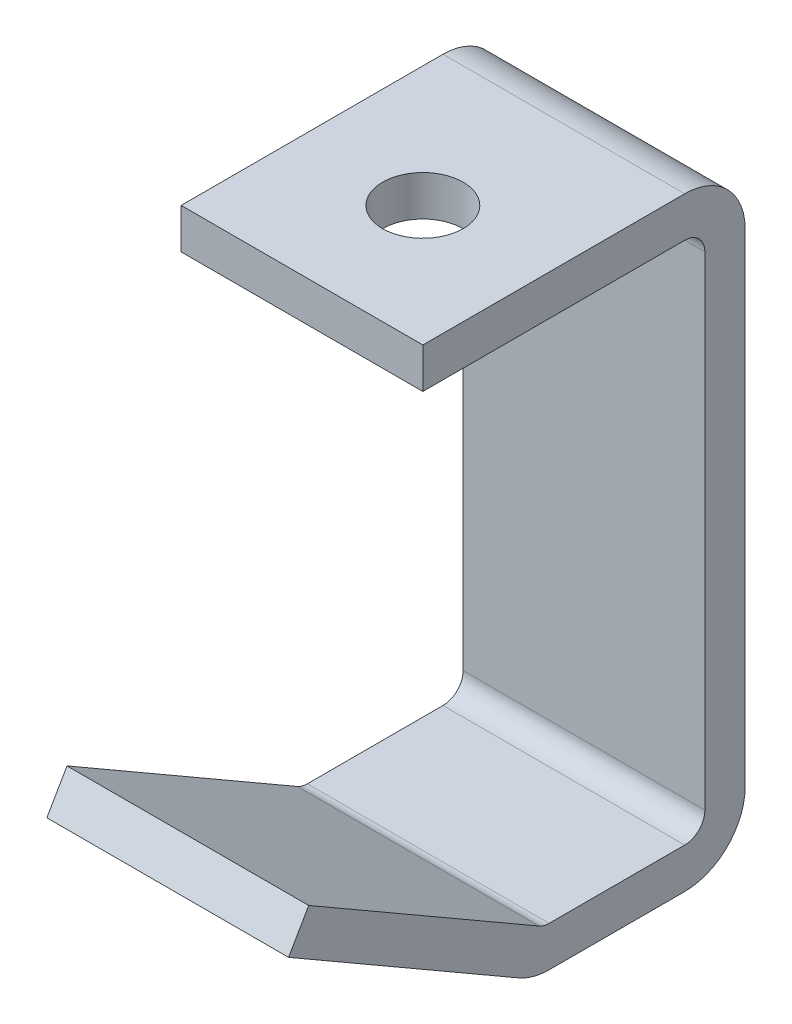
from build123d import *

# Parameters (mm, degrees)
EXTRUDE_1_DEPTH     = 38.1
SKETCH_2_W          = 38.1
SKETCH_2_H          = 6.35
EXTRUDE_2_DEPTH     = 88.9
SKETCH_3_W          = 38.1
SKETCH_3_H          = 6.35
EXTRUDE_3_DEPTH     = 44.45
HOLE_WIZARD_1_D     = 12.7
HOLE_WIZARD_1_DEPTH = 6.35
FILLET_1_R          = 3.175
FILLET_2_R          = 9.525


with BuildPart() as part:
    # 스케치1 → 보스-돌출1 (new body)
    with BuildSketch(Plane(origin=(38.1, 0, 0), x_dir=(0, 0, -1), z_dir=(1, 0, 0))):
        Polygon((0, 0), (0, 6.35), (-31.75, 6.35), (-68.793024211, 27.7368), (-71.968024211, 22.237538686), (-33.451477372, 0), align=None)
    extrude(amount=-EXTRUDE_1_DEPTH)

    # 스케치2 → 보스-돌출2 (add)
    with BuildSketch(Plane(origin=(0, 6.35, 0), x_dir=(-1, 0, 0), z_dir=(0, 1, 0))):
        with Locations((-19.05, 3.175)):
            Rectangle(SKETCH_2_W, SKETCH_2_H)
    extrude(amount=EXTRUDE_2_DEPTH)

    # 스케치3 → 보스-돌출3 (add)
    with BuildSketch(Plane.XY.offset(6.35)):
        with Locations((19.05, 92.075)):
            Rectangle(SKETCH_3_W, SKETCH_3_H)
    extrude(amount=EXTRUDE_3_DEPTH)

    # 구멍1
    with Locations(Plane(origin=(0, 95.25, 0), x_dir=(1, 0, 0), z_dir=(0, 1, 0))):
        with Locations((19.05, -31.75)):
            Hole(HOLE_WIZARD_1_D / 2, depth=HOLE_WIZARD_1_DEPTH)

    # 필렛1
    fillet_1_edges = [part.edges().sort_by_distance(p)[0] for p in [
        (19.05, 6.35, 31.75),
        (19.05, 6.35, 6.35),
        (19.05, 88.9, 6.35),
    ]]
    fillet(fillet_1_edges, radius=FILLET_1_R)

    # 필렛2
    fillet_2_edges = [part.edges().sort_by_distance(p)[0] for p in [
        (19.05, 0, 33.451477372),
        (19.05, 0, 0),
        (19.05, 95.25, 0),
    ]]
    fillet(fillet_2_edges, radius=FILLET_2_R)


solid = part.part
